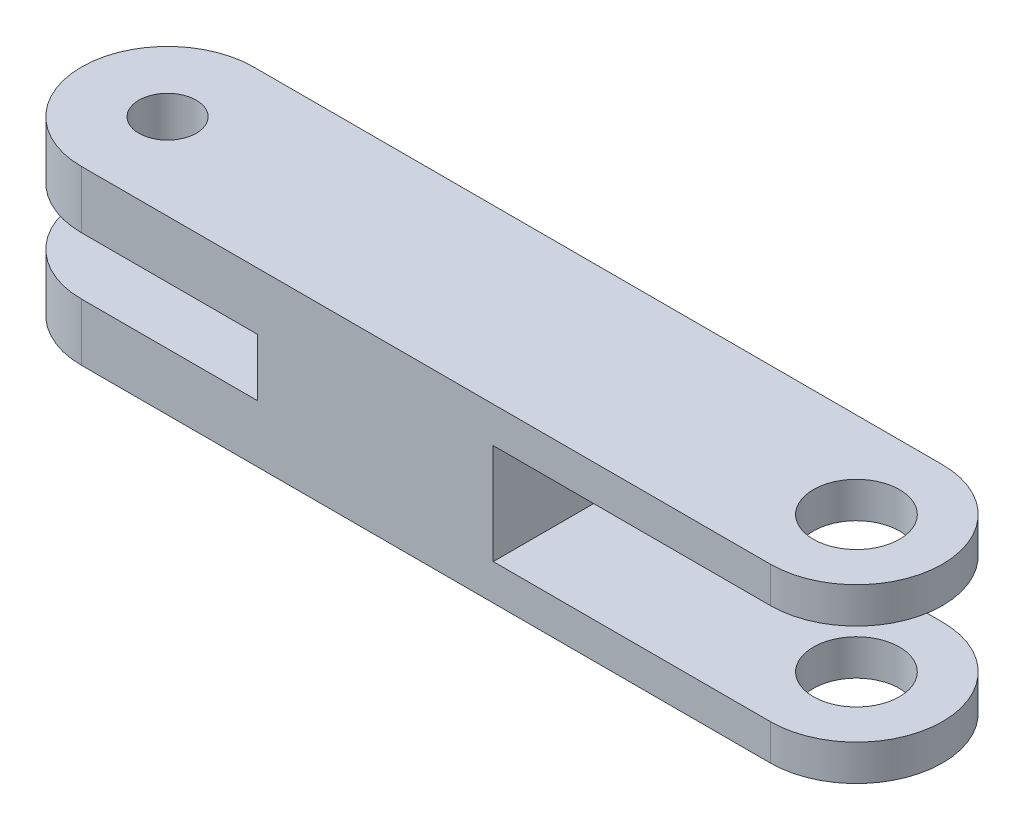
from build123d import *

# Parameters (mm, degrees)
SKETCH_1_R          = 1.5
SKETCH_1_R_2        = 1
EXTRUDE_1_DEPTH     = 3
SKETCH_6_W          = 31.511370345
SKETCH_6_H          = 11.605197544
CUT_EXTRUDE_2_DEPTH = 1.75
SKETCH_7_W          = 12.660216836
SKETCH_7_H          = 9.649927943
CUT_EXTRUDE_3_DEPTH = 1


with BuildPart() as part:
    # 草图1 → 凸台-拉伸1 (new, symmetric)
    with BuildSketch(Plane(origin=(0, 0, 0), x_dir=(1, 0, 0), z_dir=(0, 1, 0))):
        with BuildLine():
            Line((0, 3), (24, 3))
            ThreePointArc((24, 3), (27, 0), (24, -3))
            Line((24, -3), (0, -3))
            ThreePointArc((0, -3), (-3, 0), (0, 3))
        make_face()
        with Locations(Location((24, 0, 0), (0, 0, 270))):
            Circle(SKETCH_1_R, mode=Mode.SUBTRACT)
        with Locations(Location((0, 0, 0), (0, 0, 270))):
            Circle(SKETCH_1_R_2, mode=Mode.SUBTRACT)
    extrude(amount=EXTRUDE_1_DEPTH, both=True)

    # 草图6 → 切除-拉伸2 (cut, symmetric)
    with BuildSketch(Plane(origin=(0, 0, 0), x_dir=(1, 0, 0), z_dir=(0, 1, 0))):
        with Locations((30.101826092, 2.040608699)):
            Rectangle(SKETCH_6_W, SKETCH_6_H)
    extrude(amount=CUT_EXTRUDE_2_DEPTH, both=True, mode=Mode.SUBTRACT)

    # 草图7 → 切除-拉伸3 (cut, symmetric)
    with BuildSketch(Plane(origin=(0, 0, 0), x_dir=(1, 0, 0), z_dir=(0, 1, 0))):
        with Locations((-0.191074288, 0.210879474)):
            Rectangle(SKETCH_7_W, SKETCH_7_H)
    extrude(amount=CUT_EXTRUDE_3_DEPTH, both=True, mode=Mode.SUBTRACT)


solid = part.part
